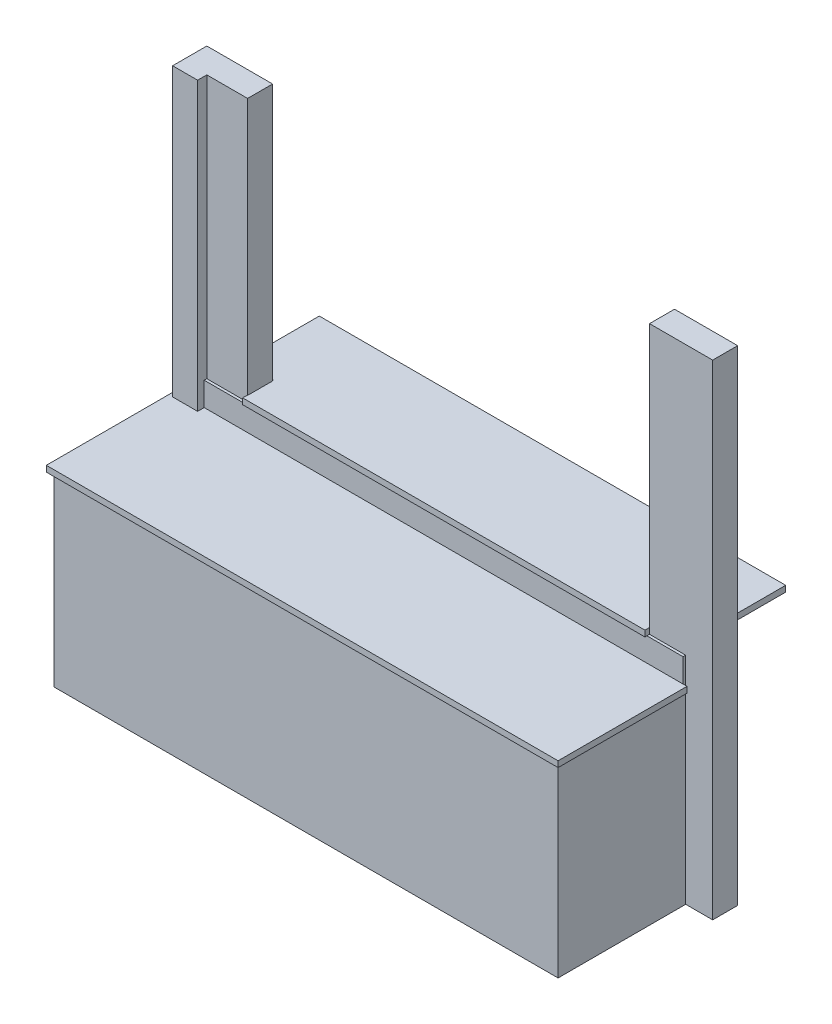
from build123d import *

# Parameters (mm, degrees)
SKETCH1_W                       = 2470.15
SKETCH1_H                       = 622.3
BOSS_EXTRUDE1_DEPTH             = 28.575
SKETCH2_W                       = 2432.05
SKETCH2_H                       = 736.6
BOSS_EXTRUDE2_DEPTH             = 898.525
SKETCH3_W                       = 2432.05
SKETCH3_H                       = 133.35
BOSS_EXTRUDE3_DEPTH             = 142.875
BOSS_EXTRUDE4_DEPTH             = 28.575
BOSS_EXTRUDE5_DEPTH             = 1270
BOSS_EXTRUDE5_DIRECTION_2_REACH = 1817.661
BOSS_EXTRUDE6_DEPTH             = 1270
BOSS_EXTRUDE6_DEPTH_BACK        = 1069.975
SKETCH6_W                       = 304.8
SKETCH6_H                       = 120.65


with BuildPart() as part:
    # Sketch1 → Boss-Extrude1 (new body)
    with BuildSketch(Plane(origin=(0, 0, 0), x_dir=(1, 0, 0), z_dir=(0, 1, 0))):
        Rectangle(SKETCH1_W, SKETCH1_H)
    extrude(amount=-BOSS_EXTRUDE1_DEPTH)

    # Sketch2 → Boss-Extrude2 (add)
    with BuildSketch(Plane.XZ.offset(28.575)):
        with Locations((0, -76.2)):
            Rectangle(SKETCH2_W, SKETCH2_H)
    extrude(amount=BOSS_EXTRUDE2_DEPTH)

    # Sketch3 → Boss-Extrude3 (add)
    with BuildSketch(Plane(origin=(0, -28.575, 0), x_dir=(1, 0, 0), z_dir=(0, 1, 0))):
        with Locations((0, 377.825)):
            Rectangle(SKETCH3_W, SKETCH3_H)
    extrude(amount=BOSS_EXTRUDE3_DEPTH)

    # Sketch4 → Boss-Extrude4 (add)
    with BuildSketch(Plane(origin=(0, 114.3, 0), x_dir=(1, 0, 0), z_dir=(0, 1, 0))):
        Polygon((-1057.275, 828.675), (1193.8, 828.675), (1193.8, 450.85), (1041.4, 450.85), (1041.4, 301.625), (-900.1125, 301.625), (-900.1125, 450.85), (-1057.275, 450.85), align=None)
    extrude(amount=BOSS_EXTRUDE4_DEPTH)

    # Sketch5 → Boss-Extrude5 (add)
    with BuildSketch(Plane(origin=(0, 114.3, 0), x_dir=(1, 0, 0), z_dir=(0, 1, 0))):
        Polygon((-1216.025, 444.5), (-1216.025, 279.4), (-1095.375, 279.4), (-1095.375, 323.85), (-898.525, 323.85), (-898.525, 444.5), align=None)
    extrude(amount=BOSS_EXTRUDE5_DEPTH)

    # Boss-Extrude5 direction 2: up to this face of the body (flat: up to its plane)
    boss_extrude5_direction_2_end = Plane(part.part.faces().sort_by_distance((0, 0, 0))[0])
    # Sketch5 → Boss-Extrude5 direction 2 (add, up to the picked face)
    with BuildSketch(Plane(origin=(0, 114.3, 0), x_dir=(1, 0, 0), z_dir=(0, 1, 0)), mode=Mode.PRIVATE) as boss_extrude5_direction_2_sk1:
        Polygon((-1216.025, 444.5), (-1216.025, 279.4), (-1095.375, 279.4), (-1095.375, 323.85), (-898.525, 323.85), (-898.525, 444.5), align=None)
    boss_extrude5_direction_2_tool1 = split(extrude(boss_extrude5_direction_2_sk1.sketch, amount=-BOSS_EXTRUDE5_DIRECTION_2_REACH, mode=Mode.PRIVATE), bisect_by=boss_extrude5_direction_2_end, keep=Keep.BOTH, mode=Mode.PRIVATE)
    add(boss_extrude5_direction_2_tool1.solids().sort_by(Axis((-1069.362281, 114.3, -374.037281), (0, -1, 0)))[0])

    # Sketch6 → Boss-Extrude6 (add, two sides: drawn at the far end of the back side and taken through both)
    with BuildSketch(Plane(origin=(0, 142.875, 0), x_dir=(1, 0, 0), z_dir=(0, 1, 0)).offset(-BOSS_EXTRUDE6_DEPTH_BACK)):
        with Locations((1193.8, 384.175)):
            Rectangle(SKETCH6_W, SKETCH6_H)
    extrude(amount=BOSS_EXTRUDE6_DEPTH + BOSS_EXTRUDE6_DEPTH_BACK)


solid = part.part
